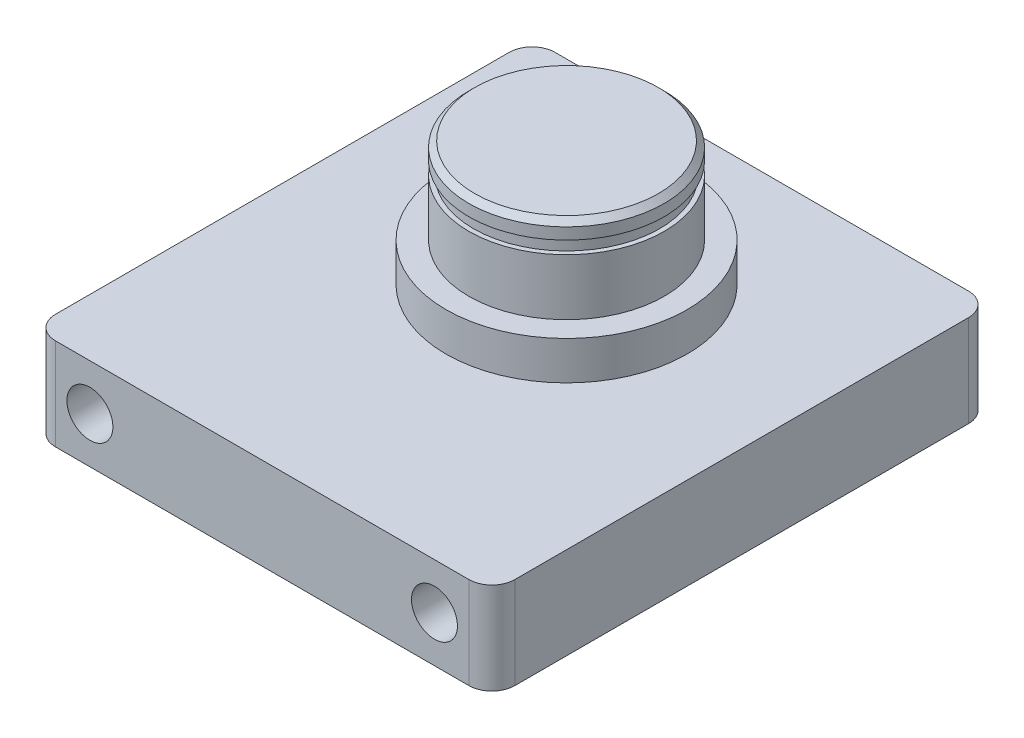
from build123d import *

# Parameters (mm, degrees)
SKETCH_1_W          = 40
SKETCH_1_H          = 43.5
EXTRUDE_1_DEPTH     = 8
SKETCH_2_R          = 10.5
EXTRUDE_2_DEPTH     = 3.35
SKETCH_3_R          = 8.5
EXTRUDE_3_DEPTH     = 7.5
SKETCH_4_R          = 2
CUT_EXTRUDE_1_DEPTH = 52.454567339
CUT_EXTRUDE_START   = -1.1
SKETCH_5_R          = 8.5
SKETCH_5_R_2        = 8.1
CUT_EXTRUDE_2_DEPTH = 1.1
CHAMFER_1_SIZE      = 0.5
FILLET_1_R          = 2


with BuildPart() as part:
    # 草图1 → 凸台-拉伸1 (new body)
    with BuildSketch(Plane(origin=(0, 0, 0), x_dir=(1, 0, 0), z_dir=(0, 1, 0))):
        with Locations((0, -4.75)):
            Rectangle(SKETCH_1_W, SKETCH_1_H)
    extrude(amount=EXTRUDE_1_DEPTH)

    # 草图2 → 凸台-拉伸2 (add)
    with BuildSketch(Plane(origin=(0, 8, 0), x_dir=(1, 0, 0), z_dir=(0, 1, 0))):
        with Locations(Location((0, 0, 0), (0, 0, 270))):
            Circle(SKETCH_2_R)
    extrude(amount=EXTRUDE_2_DEPTH)

    # 草图3 → 凸台-拉伸3 (add)
    with BuildSketch(Plane(origin=(0, 11.35, 0), x_dir=(1, 0, 0), z_dir=(0, 1, 0))):
        with Locations(Location((0, 0, 0), (0, 0, 270))):
            Circle(SKETCH_3_R)
    extrude(amount=EXTRUDE_3_DEPTH)

    # 草图4 → 切除-拉伸1 (cut, through all)
    with BuildSketch(Plane(origin=(0, 0, -17), x_dir=(-1, 0, 0), z_dir=(0, 0, -1))):
        with Locations((-15, 4)):
            Circle(SKETCH_4_R)
        with Locations((15, 4)):
            Circle(SKETCH_4_R)
    extrude(amount=-CUT_EXTRUDE_1_DEPTH, mode=Mode.SUBTRACT)

    # 草图5 → 切除-拉伸2 (cut)
    with BuildSketch(Plane(origin=(0, 17.35, 0), x_dir=(1, 0, 0), z_dir=(0, 1, 0)).offset(CUT_EXTRUDE_START)):
        with Locations(Location((0, 0, 0), (0, 0, 270))):
            Circle(SKETCH_5_R)
        with Locations(Location((0, 0, 0), (0, 0, 270))):
            Circle(SKETCH_5_R_2, mode=Mode.SUBTRACT)
    extrude(amount=CUT_EXTRUDE_2_DEPTH, mode=Mode.SUBTRACT)

    # 倒角1
    chamfer_1_edges = [part.edges().sort_by_distance(p)[0] for p in [
        (0, 18.85, -8.5),
    ]]
    chamfer(chamfer_1_edges, length=CHAMFER_1_SIZE)

    # 圆角1
    fillet_1_edges = [part.edges().sort_by_distance(p)[0] for p in [
        (20, 4, 26.5),
        (-20, 4, 26.5),
        (-20, 4, -17),
        (20, 4, -17),
    ]]
    fillet(fillet_1_edges, radius=FILLET_1_R)


solid = part.part
